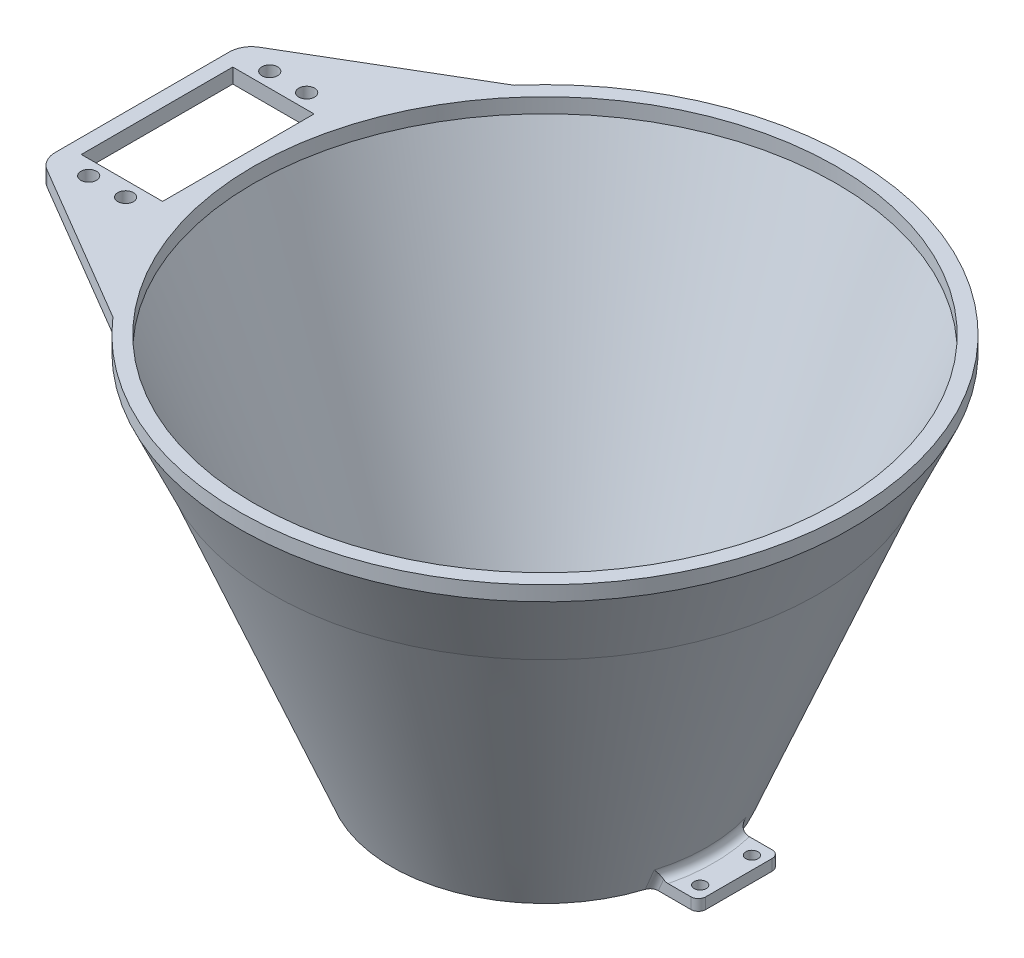
from build123d import *

# Parameters (mm, degrees)
SKETCH3_R           = 1.65
BOSS_EXTRUDE1_DEPTH = 3
FILLET1_R           = 2
SKETCH4_R           = 2.125
SKETCH4_W           = 22
SKETCH4_H           = 41
BOSS_EXTRUDE2_DEPTH = 4
BOSS_EXTRUDE3_DEPTH = 4
FILLET5_R           = 6


with BuildPart() as part:
    # Sketch2 → Revolve1 (revolve)
    with BuildSketch(Plane.XY, mode=Mode.PRIVATE) as revolve1_sk:
        Polygon((38.5, 0), (78.902622584, 100), (81.902622584, 100), (41.5, 0), align=None)
    revolve(revolve1_sk.sketch.rotate(Axis((0, 0, 0), (0, 1, 0)), 90), axis=Axis((0, 0, 0), (0, 1, 0)))

    # Sketch3 → Boss-Extrude1 (add)
    # profile 1 of 2: a face of its own
    with BuildSketch(Plane.XZ):
        with BuildLine():
            Line((-52.515621949, 11), (-40.015621949, 11))
            ThreePointArc((-40.015621949, 11), (-41.5, 0), (-40.015621949, -11))
            Line((-40.015621949, -11), (-52.515621949, -11))
            Line((-52.515621949, -11), (-52.515621949, 11))
        make_face()
        with Locations(Location((-49.015621949, -7, 0), (0, 0, 270))):
            Circle(SKETCH3_R, mode=Mode.SUBTRACT)
        with Locations(Location((-49.015621949, 7, 0), (0, 0, 90))):
            Circle(SKETCH3_R, mode=Mode.SUBTRACT)
    # profile 2 of 2: a face of its own
    with BuildSketch(Plane.XZ):
        with BuildLine():
            Line((52.515621949, -11), (40.015621949, -11))
            ThreePointArc((40.015621949, -11), (41.5, 0), (40.015621949, 11))
            Line((40.015621949, 11), (52.515621949, 11))
            Line((52.515621949, 11), (52.515621949, -11))
        make_face()
        with Locations(Location((49.015621949, 7, 0), (0, 0, 270))):
            Circle(SKETCH3_R, mode=Mode.SUBTRACT)
        with Locations(Location((49.015621949, -7, 0), (0, 0, 90))):
            Circle(SKETCH3_R, mode=Mode.SUBTRACT)
    extrude(amount=-BOSS_EXTRUDE1_DEPTH)

    # Fillet1
    fillet1_edges = [part.edges().sort_by_distance(p)[0] for p in [
        (-42.712078678, 3, 0),
        (-40.643751515, 1.499882095, -11),
        (-40.643751515, 1.499882095, 11),
        (-52.515621949, 1.5, -11),
        (-52.515621949, 1.5, 11),
        (42.712078678, 3, 0),
        (40.643751515, 1.499882095, -11),
        (40.643751515, 1.499882095, 11),
        (52.515621949, 1.5, 11),
        (52.515621949, 1.5, -11),
    ]]
    fillet(fillet1_edges, radius=FILLET1_R)



with BuildPart() as body_2:
    # Sketch4 → Boss-Extrude2 (new body)
    with BuildSketch(Plane(origin=(0, 100, 0), x_dir=(1, 0, 0), z_dir=(0, 1, 0))):
        with BuildLine():
            Line((-59.767157628, 55.999343346), (-109, 27))
            Line((-109, 27), (-109, -27))
            Line((-109, -27), (-59.767157628, -55.999343346))
            Line((-59.767157628, -55.999343346), (-45.982961788, -64.118570444))
            ThreePointArc((-45.982961788, -64.118570444), (-78.902622584, 0), (-45.982961788, 64.118570444))
            Line((-45.982961788, 64.118570444), (-59.767157628, 55.999343346))
        make_face()
        with Locations(Location((-99, -24.5, 0), (0, 0, 270))):
            Circle(SKETCH4_R, mode=Mode.SUBTRACT)
        with Locations(Location((-89, -24.5, 0), (0, 0, 270))):
            Circle(SKETCH4_R, mode=Mode.SUBTRACT)
        with Locations((-94, 0)):
            Rectangle(SKETCH4_W, SKETCH4_H, mode=Mode.SUBTRACT)
        with Locations(Location((-99, 24.5, 0), (0, 0, 270))):
            Circle(SKETCH4_R, mode=Mode.SUBTRACT)
        with Locations(Location((-89, 24.5, 0), (0, 0, 270))):
            Circle(SKETCH4_R, mode=Mode.SUBTRACT)
    extrude(amount=BOSS_EXTRUDE2_DEPTH)


with BuildPart() as part_1:
    add(part.part)

    add(body_2.part)  # Revolve5 merges body 2
    # Sketch6 → Revolve5 (revolve)
    with BuildSketch(Plane.XY, mode=Mode.PRIVATE) as revolve5_sk:
        Polygon((-81.902622584, 100), (-82.902622584, 100), (-73.822098067, 80), align=None)
    revolve(revolve5_sk.sketch.rotate(Axis((0, 0, 0), (0, 1, 0)), 54.353606802), axis=Axis((0, 0, 0), (0, 1, 0)))

    # Sketch7 → Boss-Extrude3 (add)
    with BuildSketch(Plane(origin=(0, 100, 0), x_dir=(1, 0, 0), z_dir=(0, 1, 0))):
        with BuildLine():
            Line((-62.63684504, 54.309027562), (-45.982961788, 64.118570444))
            ThreePointArc((-45.982961788, 64.118570444), (78.902622584, 0), (-45.982961788, -64.118570444))
            Line((-45.982961788, -64.118570444), (-62.63684504, -54.309027562))
            ThreePointArc((-62.63684504, -54.309027562), (82.902622584, 0), (-62.63684504, 54.309027562))
        make_face()
    extrude(amount=BOSS_EXTRUDE3_DEPTH)

    # Fillet5
    fillet5_edges = [part_1.edges().sort_by_distance(p)[0] for p in [
        (-109, 102, -27),
        (-109, 102, 27),
    ]]
    fillet(fillet5_edges, radius=FILLET5_R)


solid = part_1.part
